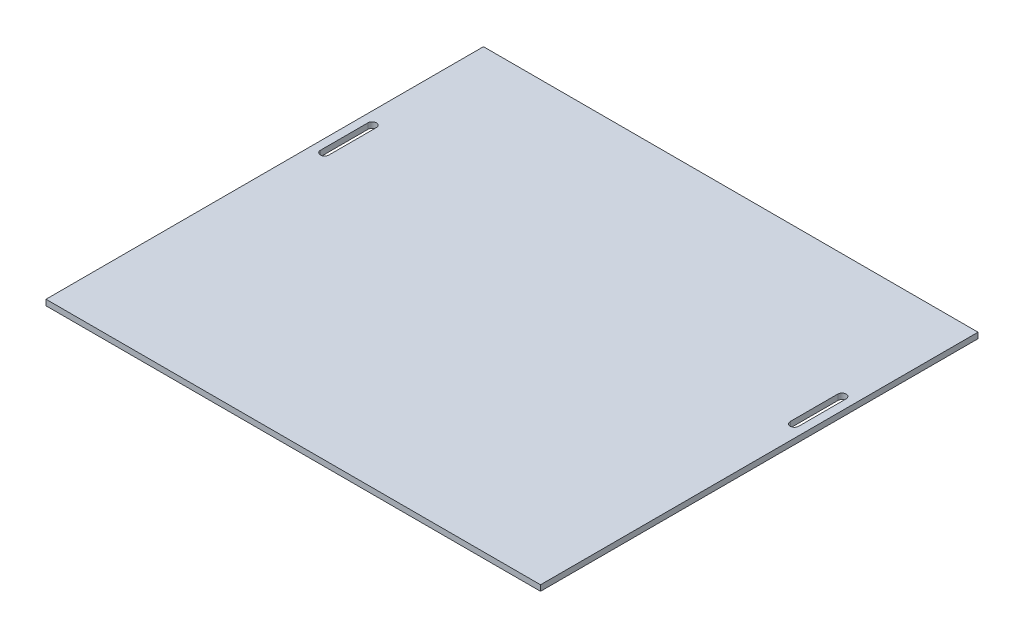
from build123d import *

# Parameters (mm, degrees)
SKETCH1_W           = 260
SKETCH1_H           = 230
BOSS_EXTRUDE1_DEPTH = 3
CUT_EXTRUDE1_DEPTH  = 348.144062314


with BuildPart() as part:
    # Sketch1 → Boss-Extrude1 (new body)
    with BuildSketch(Plane(origin=(0, 0, 0), x_dir=(1, 0, 0), z_dir=(0, 1, 0))):
        with Locations((130, -115)):
            Rectangle(SKETCH1_W, SKETCH1_H)
    extrude(amount=BOSS_EXTRUDE1_DEPTH)

    # Sketch2 → Cut-Extrude1 (cut, through all)
    with BuildSketch(Plane(origin=(0, 3, 0), x_dir=(1, 0, 0), z_dir=(0, 1, 0))):
        with BuildLine():
            Line((8.7, -65), (8.7, -90))
            ThreePointArc((8.7, -90), (6.5, -92.2), (4.3, -90))
            Line((4.3, -90), (4.3, -65))
            ThreePointArc((4.3, -65), (6.5, -62.8), (8.7, -65))
        make_face()
        with BuildLine():
            Line((251.3, -65), (251.3, -90))
            ThreePointArc((251.3, -90), (253.5, -92.2), (255.7, -90))
            Line((255.7, -90), (255.7, -65))
            ThreePointArc((255.7, -65), (253.5, -62.8), (251.3, -65))
        make_face()
    extrude(amount=-CUT_EXTRUDE1_DEPTH, mode=Mode.SUBTRACT)


solid = part.part
